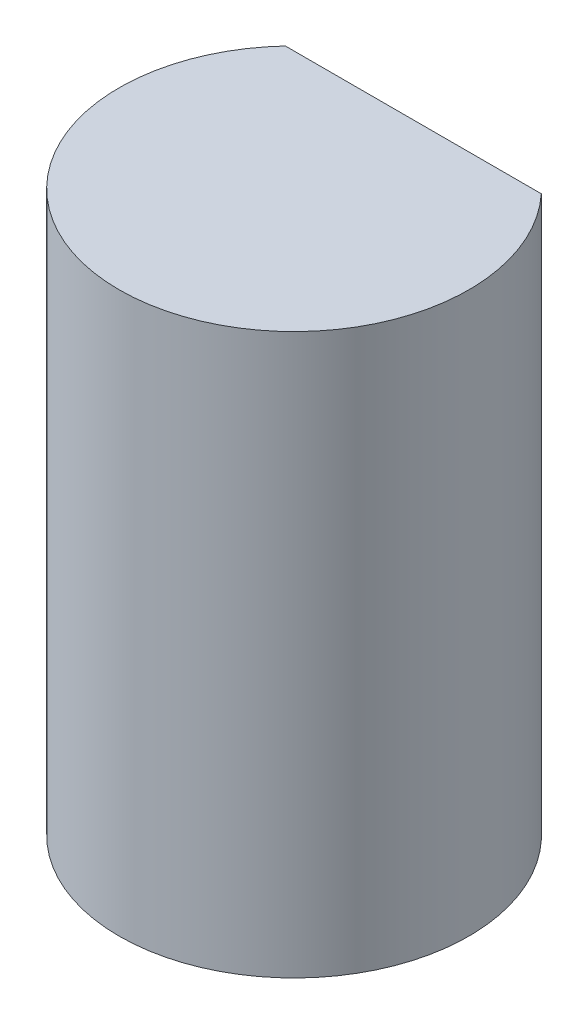
from build123d import *

# Parameters (mm, degrees)
SKETCH1_R           = 3.96875
BOSS_EXTRUDE1_DEPTH = 6.35
CUT_EXTRUDE1_REACH  = 15.885


with BuildPart() as part:
    # Sketch1 → Boss-Extrude1 (new, symmetric)
    with BuildSketch(Plane(origin=(0, 0, 0), x_dir=(1, 0, 0), z_dir=(0, 1, 0))):
        with Locations(Location((0, 0, 0), (0, 0, 270))):
            Circle(SKETCH1_R)
    extrude(amount=BOSS_EXTRUDE1_DEPTH, both=True)

    # Sketch2 → Cut-Extrude1 (cut, up to next)
    with BuildSketch(Plane(origin=(0, 6.35, 0), x_dir=(1, 0, 0), z_dir=(0, 1, 0)), mode=Mode.PRIVATE) as cut_extrude1_sk1:
        with BuildLine():
            Line((-2.902950916, 2.706261729), (2.902950916, 2.706261729))
            ThreePointArc((2.902950916, 2.706261729), (0, 3.96875), (-2.902950916, 2.706261729))
        make_face()
    cut_extrude1_tool1 = extrude(cut_extrude1_sk1.sketch, amount=-CUT_EXTRUDE1_REACH, mode=Mode.PRIVATE) & part.part
    add(cut_extrude1_tool1.solids().sort_by_distance((0, 6.35, -3.218844))[0], mode=Mode.SUBTRACT)


solid = part.part
